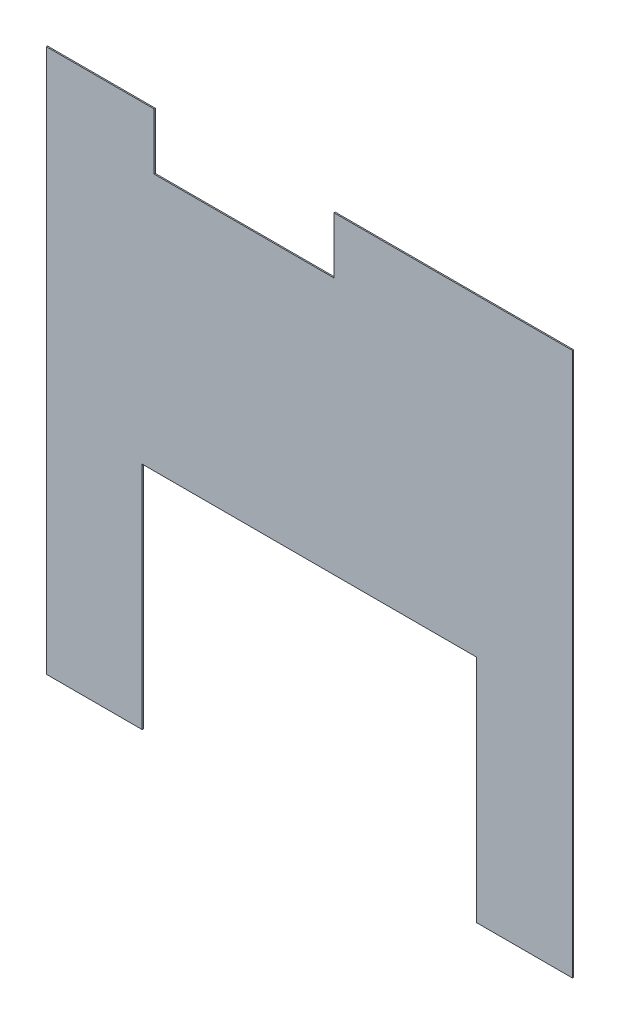
from build123d import *

# Parameters (mm, degrees)
CROQUIS1_W              = 1258.2
CROQUIS1_H              = 1300
SALIENTE_EXTRUIR1_DEPTH = 2.9
CROQUIS2_W              = 800
CROQUIS2_H              = 550
CORTAR_EXTRUIR1_DEPTH   = 2.9
CROQUIS3_W              = 430
CROQUIS3_H              = 135
CORTAR_EXTRUIR2_DEPTH   = 10


with BuildPart() as part:
    # Croquis1 → Saliente-Extruir1 (new body)
    with BuildSketch(Plane.XY):
        with Locations((629.1, -650)):
            Rectangle(CROQUIS1_W, CROQUIS1_H)
    extrude(amount=SALIENTE_EXTRUIR1_DEPTH)

    # Croquis2 → Cortar-Extruir1 (cut)
    with BuildSketch(Plane.XY.offset(2.9)):
        with Locations((629.1, -1025)):
            Rectangle(CROQUIS2_W, CROQUIS2_H)
    extrude(amount=-CORTAR_EXTRUIR1_DEPTH, mode=Mode.SUBTRACT)

    # Croquis3 → Cortar-Extruir2 (cut)
    with BuildSketch(Plane.XY.offset(2.9)):
        with Locations((473, -67.5)):
            Rectangle(CROQUIS3_W, CROQUIS3_H)
    extrude(amount=-CORTAR_EXTRUIR2_DEPTH, mode=Mode.SUBTRACT)


solid = part.part
